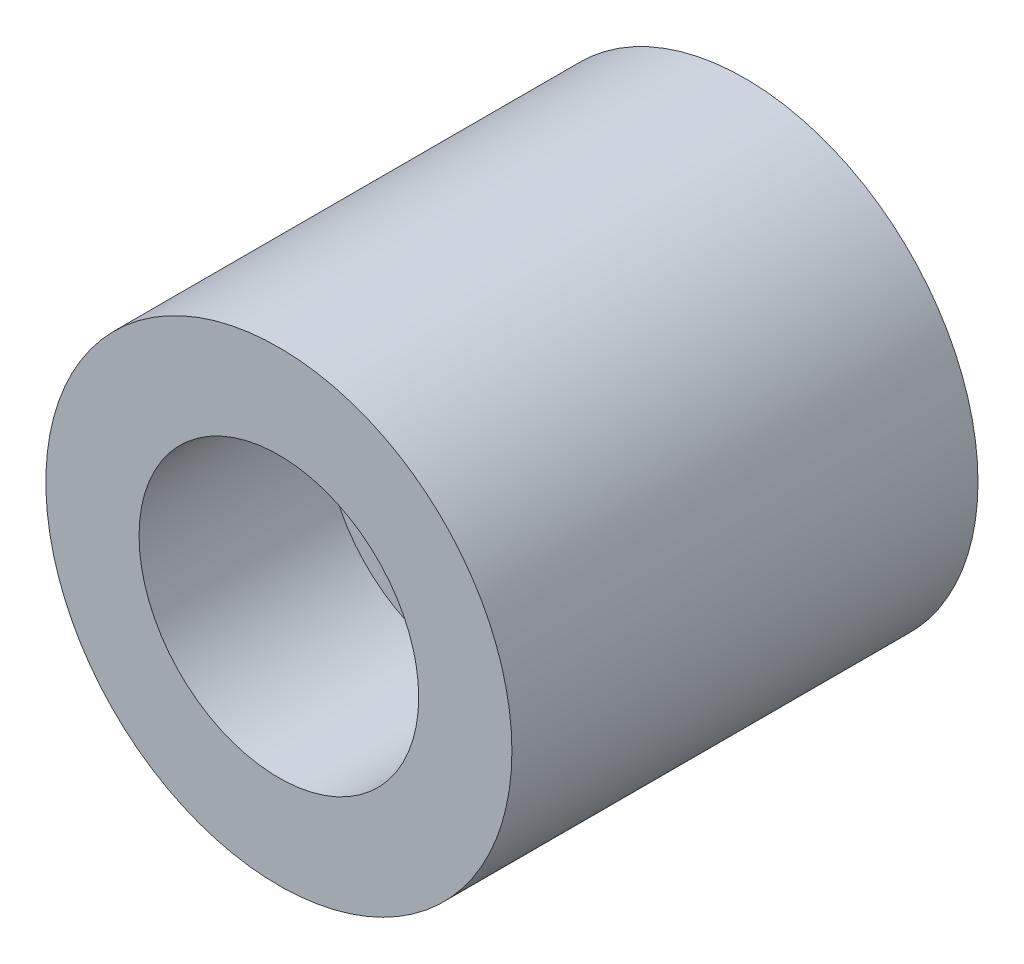
from build123d import *

# Parameters (mm, degrees)
SKETCH_BASE_PROFILE_R        = 10
FEATURE_BASE_DEPTH           = 20
SKETCH_BORE_PROFILE_R        = 3
FEATURE_BORE_DEPTH           = 25.494897428
SKETCH_COUNTERBORE_PROFILE_R = 6
FEATURE_COUNTERBORE_DEPTH    = 8


with BuildPart() as part:
    # sketch:base-profile → feature:base (new body)
    with BuildSketch(Plane.XY):
        Circle(SKETCH_BASE_PROFILE_R)
    extrude(amount=FEATURE_BASE_DEPTH)

    # sketch:bore-profile → feature:bore (cut, through all)
    with BuildSketch(Plane.XY.offset(20)):
        Circle(SKETCH_BORE_PROFILE_R)
    extrude(amount=-FEATURE_BORE_DEPTH, mode=Mode.SUBTRACT)

    # sketch:counterbore-profile → feature:counterbore (cut)
    with BuildSketch(Plane.XY.offset(20)):
        Circle(SKETCH_COUNTERBORE_PROFILE_R)
    extrude(amount=-FEATURE_COUNTERBORE_DEPTH, mode=Mode.SUBTRACT)


solid = part.part
